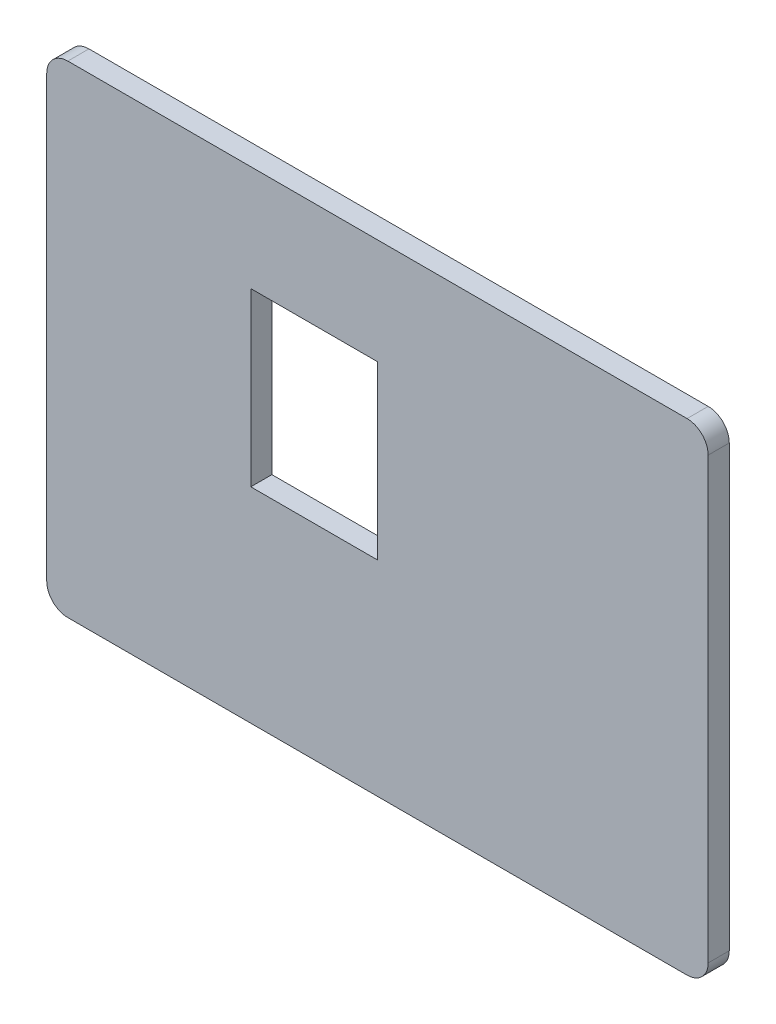
from build123d import *

# Parameters (mm, degrees)
CROQUIS1_W              = 47
CROQUIS1_H              = 34.25
SALIENTE_EXTRUIR1_DEPTH = 1.5
CROQUIS2_W              = 9
CROQUIS2_H              = 12.2
CORTAR_EXTRUIR5_DEPTH   = 21.5
CORTAR_EXTRUIR6_DEPTH   = 21.5


with BuildPart() as part:
    # Croquis1 → Saliente-Extruir1 (new body)
    with BuildSketch(Plane.XY):
        with Locations((-1.565239082, -10.286716172)):
            Rectangle(CROQUIS1_W, CROQUIS1_H)
    extrude(amount=SALIENTE_EXTRUIR1_DEPTH)

    # Croquis2 → Cortar-Extruir5 (cut)
    with BuildSketch(Plane.XY):
        with Locations((-6.065239082, -6.761716172)):
            Rectangle(CROQUIS2_W, CROQUIS2_H)
    extrude(amount=CORTAR_EXTRUIR5_DEPTH, mode=Mode.SUBTRACT)

    # Croquis3 → Cortar-Extruir6 (cut)
    with BuildSketch(Plane.XY):
        with BuildLine():
            Line((-25.065239082, -25.911716172), (-25.065239082, -27.411716172))
            Line((-25.065239082, -27.411716172), (-23.565239082, -27.411716172))
            ThreePointArc((-23.565239082, -27.411716172), (-24.625899254, -26.972376343), (-25.065239082, -25.911716172))
        make_face()
        with BuildLine():
            Line((-25.065239082, 5.338283828), (-25.065239082, 6.838283828))
            Line((-25.065239082, 6.838283828), (-23.565239082, 6.838283828))
            ThreePointArc((-23.565239082, 6.838283828), (-24.625899254, 6.398944), (-25.065239082, 5.338283828))
        make_face()
        with BuildLine():
            Line((20.434760918, 6.838283828), (21.934760918, 6.838283828))
            Line((21.934760918, 6.838283828), (21.934760918, 5.338283828))
            ThreePointArc((21.934760918, 5.338283828), (21.49542109, 6.398944), (20.434760918, 6.838283828))
        make_face()
        with BuildLine():
            Line((21.934760918, -27.411716172), (21.934760918, -25.911716172))
            ThreePointArc((21.934760918, -25.911716172), (21.49542109, -26.972376343), (20.434760918, -27.411716172))
            Line((20.434760918, -27.411716172), (21.934760918, -27.411716172))
        make_face()
    extrude(amount=CORTAR_EXTRUIR6_DEPTH, mode=Mode.SUBTRACT)


solid = part.part
